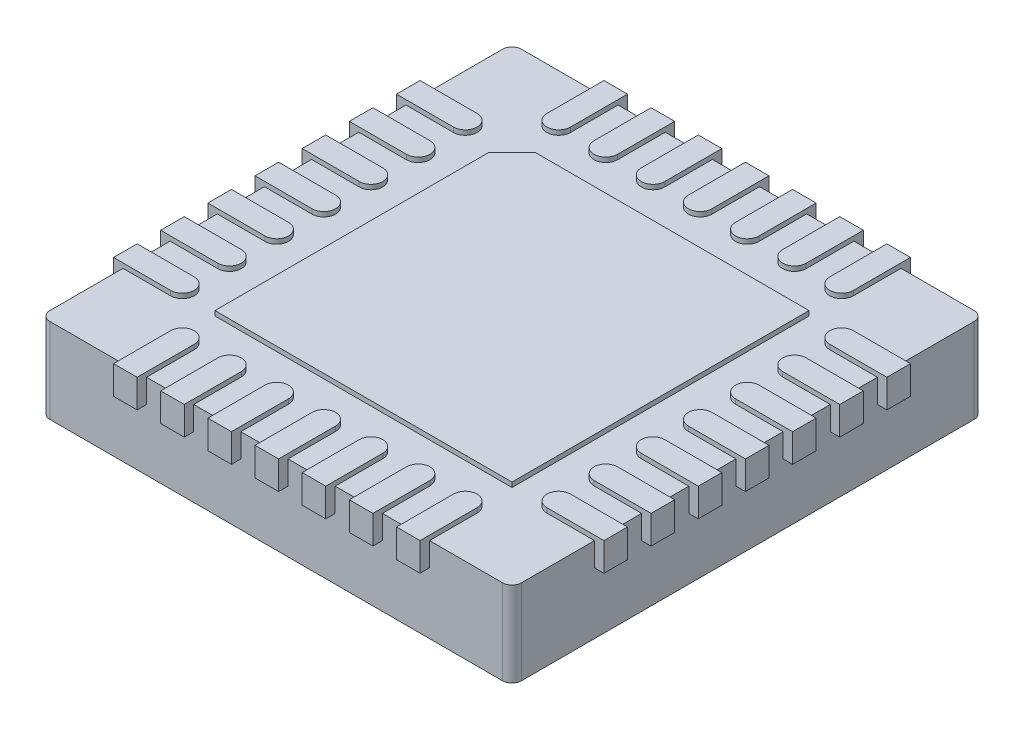
from build123d import *

# Parameters (mm, degrees)
BOSS_EXTRUDE1_DEPTH      = 0.9
BOSS_EXTRUDE2_DEPTH      = 0.05
BOSS_EXTRUDE2_DEPTH_BACK = 0.25
BOSS_EXTRUDE4_DEPTH      = 0.01


with BuildPart() as part:
    # Sketch1 → Boss-Extrude1 (new body)
    with BuildSketch(Plane(origin=(0, 0, 0), x_dir=(1, 0, 0), z_dir=(0, 1, 0))):
        with BuildLine():
            Line((2.4, -2.5), (-2.4, -2.5))
            ThreePointArc((-2.4, -2.5), (-2.470710678, -2.470710678), (-2.5, -2.4))
            Line((-2.5, -2.4), (-2.5, 2.4))
            ThreePointArc((-2.5, 2.4), (-2.470710678, 2.470710678), (-2.4, 2.5))
            Line((-2.4, 2.5), (2.4, 2.5))
            ThreePointArc((2.4, 2.5), (2.470710678, 2.470710678), (2.5, 2.4))
            Line((2.5, 2.4), (2.5, -2.4))
            ThreePointArc((2.5, -2.4), (2.470710678, -2.470710678), (2.4, -2.5))
        make_face()
    extrude(amount=BOSS_EXTRUDE1_DEPTH)

    # Sketch3 → Boss-Extrude2 (add, two sides: drawn at the far end of the back side and taken through both)
    with BuildSketch(Plane(origin=(0, 0.9, 0), x_dir=(1, 0, 0), z_dir=(0, 1, 0)).offset(-BOSS_EXTRUDE2_DEPTH_BACK)):
        Polygon((-1.575, 1.327512627), (-1.327512627, 1.575), (1.575, 1.575), (1.575, -1.575), (-1.575, -1.575), align=None)
        with BuildLine():
            Line((-1.625, 2.6), (-1.375, 2.6))
            Line((-1.375, 2.6), (-1.375, 1.995))
            ThreePointArc((-1.375, 1.995), (-1.5, 1.87), (-1.625, 1.995))
            Line((-1.625, 1.995), (-1.625, 2.6))
        make_face()
        with BuildLine():
            Line((-0.875, 2.6), (-0.875, 1.995))
            ThreePointArc((-0.875, 1.995), (-1, 1.87), (-1.125, 1.995))
            Line((-1.125, 1.995), (-1.125, 2.6))
            Line((-1.125, 2.6), (-0.875, 2.6))
        make_face()
        with BuildLine():
            Line((-0.375, 2.6), (-0.375, 1.995))
            ThreePointArc((-0.375, 1.995), (-0.5, 1.87), (-0.625, 1.995))
            Line((-0.625, 1.995), (-0.625, 2.6))
            Line((-0.625, 2.6), (-0.375, 2.6))
        make_face()
        with BuildLine():
            Line((0.125, 2.6), (0.125, 1.995))
            ThreePointArc((0.125, 1.995), (0, 1.87), (-0.125, 1.995))
            Line((-0.125, 1.995), (-0.125, 2.6))
            Line((-0.125, 2.6), (0.125, 2.6))
        make_face()
        with BuildLine():
            Line((0.625, 2.6), (0.625, 1.995))
            ThreePointArc((0.625, 1.995), (0.5, 1.87), (0.375, 1.995))
            Line((0.375, 1.995), (0.375, 2.6))
            Line((0.375, 2.6), (0.625, 2.6))
        make_face()
        with BuildLine():
            Line((1.125, 2.6), (1.125, 1.995))
            ThreePointArc((1.125, 1.995), (1, 1.87), (0.875, 1.995))
            Line((0.875, 1.995), (0.875, 2.6))
            Line((0.875, 2.6), (1.125, 2.6))
        make_face()
        with BuildLine():
            Line((1.625, 2.6), (1.625, 1.995))
            ThreePointArc((1.625, 1.995), (1.5, 1.87), (1.375, 1.995))
            Line((1.375, 1.995), (1.375, 2.6))
            Line((1.375, 2.6), (1.625, 2.6))
        make_face()
        with BuildLine():
            Line((-2.6, -1.375), (-2.6, -1.625))
            Line((-2.6, -1.625), (-1.995, -1.625))
            ThreePointArc((-1.995, -1.625), (-1.87, -1.5), (-1.995, -1.375))
            Line((-1.995, -1.375), (-2.6, -1.375))
        make_face()
        with BuildLine():
            Line((-2.6, -0.875), (-2.6, -1.125))
            Line((-2.6, -1.125), (-1.995, -1.125))
            ThreePointArc((-1.995, -1.125), (-1.87, -1), (-1.995, -0.875))
            Line((-1.995, -0.875), (-2.6, -0.875))
        make_face()
        with BuildLine():
            Line((-2.6, -0.375), (-2.6, -0.625))
            Line((-2.6, -0.625), (-1.995, -0.625))
            ThreePointArc((-1.995, -0.625), (-1.87, -0.5), (-1.995, -0.375))
            Line((-1.995, -0.375), (-2.6, -0.375))
        make_face()
        with BuildLine():
            Line((-2.6, 0.125), (-2.6, -0.125))
            Line((-2.6, -0.125), (-1.995, -0.125))
            ThreePointArc((-1.995, -0.125), (-1.87, 0), (-1.995, 0.125))
            Line((-1.995, 0.125), (-2.6, 0.125))
        make_face()
        with BuildLine():
            Line((-2.6, 0.625), (-2.6, 0.375))
            Line((-2.6, 0.375), (-1.995, 0.375))
            ThreePointArc((-1.995, 0.375), (-1.87, 0.5), (-1.995, 0.625))
            Line((-1.995, 0.625), (-2.6, 0.625))
        make_face()
        with BuildLine():
            Line((-2.6, 1.125), (-2.6, 0.875))
            Line((-2.6, 0.875), (-1.995, 0.875))
            ThreePointArc((-1.995, 0.875), (-1.87, 1), (-1.995, 1.125))
            Line((-1.995, 1.125), (-2.6, 1.125))
        make_face()
        with BuildLine():
            Line((-2.6, 1.625), (-2.6, 1.375))
            Line((-2.6, 1.375), (-1.995, 1.375))
            ThreePointArc((-1.995, 1.375), (-1.87, 1.5), (-1.995, 1.625))
            Line((-1.995, 1.625), (-2.6, 1.625))
        make_face()
        with BuildLine():
            Line((2.6, 1.375), (2.6, 1.625))
            Line((2.6, 1.625), (1.995, 1.625))
            ThreePointArc((1.995, 1.625), (1.87, 1.5), (1.995, 1.375))
            Line((1.995, 1.375), (2.6, 1.375))
        make_face()
        with BuildLine():
            Line((2.6, 0.875), (2.6, 1.125))
            Line((2.6, 1.125), (1.995, 1.125))
            ThreePointArc((1.995, 1.125), (1.87, 1), (1.995, 0.875))
            Line((1.995, 0.875), (2.6, 0.875))
        make_face()
        with BuildLine():
            Line((2.6, 0.375), (2.6, 0.625))
            Line((2.6, 0.625), (1.995, 0.625))
            ThreePointArc((1.995, 0.625), (1.87, 0.5), (1.995, 0.375))
            Line((1.995, 0.375), (2.6, 0.375))
        make_face()
        with BuildLine():
            Line((2.6, -0.125), (2.6, 0.125))
            Line((2.6, 0.125), (1.995, 0.125))
            ThreePointArc((1.995, 0.125), (1.87, 0), (1.995, -0.125))
            Line((1.995, -0.125), (2.6, -0.125))
        make_face()
        with BuildLine():
            Line((2.6, -0.625), (2.6, -0.375))
            Line((2.6, -0.375), (1.995, -0.375))
            ThreePointArc((1.995, -0.375), (1.87, -0.5), (1.995, -0.625))
            Line((1.995, -0.625), (2.6, -0.625))
        make_face()
        with BuildLine():
            Line((2.6, -1.125), (2.6, -0.875))
            Line((2.6, -0.875), (1.995, -0.875))
            ThreePointArc((1.995, -0.875), (1.87, -1), (1.995, -1.125))
            Line((1.995, -1.125), (2.6, -1.125))
        make_face()
        with BuildLine():
            Line((2.6, -1.625), (2.6, -1.375))
            Line((2.6, -1.375), (1.995, -1.375))
            ThreePointArc((1.995, -1.375), (1.87, -1.5), (1.995, -1.625))
            Line((1.995, -1.625), (2.6, -1.625))
        make_face()
        with BuildLine():
            Line((1.625, -2.6), (1.625, -1.995))
            ThreePointArc((1.625, -1.995), (1.5, -1.87), (1.375, -1.995))
            Line((1.375, -1.995), (1.375, -2.6))
            Line((1.375, -2.6), (1.625, -2.6))
        make_face()
        with BuildLine():
            Line((1.125, -2.6), (1.125, -1.995))
            ThreePointArc((1.125, -1.995), (1, -1.87), (0.875, -1.995))
            Line((0.875, -1.995), (0.875, -2.6))
            Line((0.875, -2.6), (1.125, -2.6))
        make_face()
        with BuildLine():
            Line((0.625, -2.6), (0.625, -1.995))
            ThreePointArc((0.625, -1.995), (0.5, -1.87), (0.375, -1.995))
            Line((0.375, -1.995), (0.375, -2.6))
            Line((0.375, -2.6), (0.625, -2.6))
        make_face()
        with BuildLine():
            Line((0.125, -2.6), (0.125, -1.995))
            ThreePointArc((0.125, -1.995), (0, -1.87), (-0.125, -1.995))
            Line((-0.125, -1.995), (-0.125, -2.6))
            Line((-0.125, -2.6), (0.125, -2.6))
        make_face()
        with BuildLine():
            Line((-0.375, -2.6), (-0.375, -1.995))
            ThreePointArc((-0.375, -1.995), (-0.5, -1.87), (-0.625, -1.995))
            Line((-0.625, -1.995), (-0.625, -2.6))
            Line((-0.625, -2.6), (-0.375, -2.6))
        make_face()
        with BuildLine():
            Line((-0.875, -2.6), (-0.875, -1.995))
            ThreePointArc((-0.875, -1.995), (-1, -1.87), (-1.125, -1.995))
            Line((-1.125, -1.995), (-1.125, -2.6))
            Line((-1.125, -2.6), (-0.875, -2.6))
        make_face()
        with BuildLine():
            Line((-1.375, -2.6), (-1.375, -1.995))
            ThreePointArc((-1.375, -1.995), (-1.5, -1.87), (-1.625, -1.995))
            Line((-1.625, -1.995), (-1.625, -2.6))
            Line((-1.625, -2.6), (-1.375, -2.6))
        make_face()
    extrude(amount=BOSS_EXTRUDE2_DEPTH + BOSS_EXTRUDE2_DEPTH_BACK)

    # Sketch4 → Boss-Extrude4 (add)
    # profile 1 of 5: a face of its own
    with BuildSketch(Plane.XZ):
        with BuildLine():
            add(Edge.make_bspline(
                [(-1.973357372, -0.180765499), (-1.981477517, -0.176498283), (-1.997364051, -0.168149754), (-2.019995019, -0.15466662), (-2.041117437, -0.140948002), (-2.06034063, -0.126500661), (-2.077853063, -0.111631698), (-2.09370863, -0.096380456), (-2.108077846, -0.080795169), (-2.120467065, -0.064475169), (-2.131459489, -0.047710673), (-2.140771421, -0.030295064), (-2.148898372, -0.012479999), (-2.155277016, 0.006004991), (-2.160543318, 0.024906317), (-2.164164125, 0.044477604), (-2.16611203, 0.064587298), (-2.166480233, 0.078178258), (-2.166666667, 0.085059822)],
                knots=[0, 0, 0, 0, 1.264219729, 2.473363326, 3.62979159, 4.734286947, 5.785533755, 6.79450939, 7.765315851, 8.704182021, 9.615576613, 10.525715488, 11.423813905, 12.311666436, 13.218214638, 14.126256791, 15.051260205, 16, 16, 16, 16], degree=3))
            add(Edge.make_bspline(
                [(-2.166666667, 0.085059822), (-2.166447496, 0.09468816), (-2.166013675, 0.113746255), (-2.162195719, 0.141867684), (-2.156556093, 0.169289895), (-2.147988961, 0.195702027), (-2.137446698, 0.221329116), (-2.124143755, 0.245825897), (-2.109129663, 0.269895558), (-2.097055177, 0.284700144), (-2.090945513, 0.292191232)],
                knots=[0, 0, 0, 0, 1.02531512, 2.029483338, 3.018748588, 4.004195107, 4.983200899, 5.966616707, 6.971112471, 8, 8, 8, 8], degree=3))
            add(Edge.make_bspline(
                [(-2.090945513, 0.292191232), (-2.082992234, 0.30093231), (-2.067183959, 0.318306451), (-2.040103122, 0.340863826), (-2.010382584, 0.359820795), (-1.978137346, 0.375269908), (-1.943453603, 0.387294439), (-1.906338744, 0.395935159), (-1.866720415, 0.400884424), (-1.83949028, 0.40159985), (-1.825520833, 0.401966873)],
                knots=[0, 0, 0, 0, 0.954267603, 1.896743057, 2.838368354, 3.796610408, 4.779680527, 5.799409237, 6.871065594, 8, 8, 8, 8], degree=3))
            add(Edge.make_bspline(
                [(-1.825520833, 0.401966873), (-1.812088746, 0.40163671), (-1.785951268, 0.400994246), (-1.747901901, 0.396665146), (-1.712390855, 0.389000983), (-1.679249764, 0.378727923), (-1.648799092, 0.365028552), (-1.620983473, 0.348237124), (-1.595395219, 0.328732732), (-1.572837066, 0.306045982), (-1.552815461, 0.281741552), (-1.535212542, 0.256675166), (-1.520663785, 0.230865069), (-1.508123925, 0.204703859), (-1.498791835, 0.177661454), (-1.492172901, 0.150015372), (-1.488015287, 0.121844151), (-1.487459227, 0.102835651), (-1.487179487, 0.093272963)],
                knots=[0, 0, 0, 0, 1.256864279, 2.445730223, 3.576845088, 4.651810441, 5.686528262, 6.692706664, 7.686234615, 8.689148594, 9.678739427, 10.630299996, 11.55097961, 12.448208961, 13.341360817, 14.221834469, 15.105450545, 16, 16, 16, 16], degree=3))
            add(Edge.make_bspline(
                [(-1.487179487, 0.093272963), (-1.487344636, 0.086256067), (-1.48767103, 0.072388203), (-1.489928973, 0.051899595), (-1.493562128, 0.031958688), (-1.498485388, 0.012486775), (-1.505218805, -0.006413404), (-1.51320704, -0.024839317), (-1.522611109, -0.042790431), (-1.53380132, -0.059993446), (-1.546130032, -0.077057733), (-1.560765346, -0.093135972), (-1.576731536, -0.109172577), (-1.594979073, -0.124192363), (-1.614522456, -0.139436175), (-1.636273144, -0.1536299), (-1.659505878, -0.167881289), (-1.6760225, -0.176397074), (-1.684495192, -0.180765499)],
                knots=[0, 0, 0, 0, 0.941575622, 1.860885767, 2.762557628, 3.660168386, 4.552890429, 5.45184204, 6.353736508, 7.268493418, 8.204037487, 9.175167802, 10.182660057, 11.238220596, 12.344046335, 13.507168087, 14.721227736, 16, 16, 16, 16], degree=3))
            add(Edge.make_bspline(
                [(-1.684495192, -0.180765499), (-1.672911776, -0.187108088), (-1.650518112, -0.199369911), (-1.620583203, -0.221617269), (-1.595225803, -0.246149122), (-1.574715395, -0.273002386), (-1.558521389, -0.301294488), (-1.547072042, -0.330876486), (-1.539598792, -0.361418442), (-1.538841745, -0.382245024), (-1.538461538, -0.392704601)],
                knots=[0, 0, 0, 0, 1.16701039, 2.256125286, 3.287752239, 4.277689688, 5.235169525, 6.160862735, 7.076343936, 8, 8, 8, 8], degree=3))
            add(Edge.make_bspline(
                [(-1.538461538, -0.392704601), (-1.538929631, -0.403360555), (-1.53987058, -0.42478088), (-1.547453052, -0.456675915), (-1.559903073, -0.488019119), (-1.576546897, -0.518737859), (-1.59772822, -0.547432404), (-1.622799276, -0.573376403), (-1.651728528, -0.595898399), (-1.68388012, -0.614936887), (-1.718417911, -0.630506172), (-1.75491982, -0.64113509), (-1.792735292, -0.648125738), (-1.818477978, -0.648914996), (-1.831530449, -0.649315178)],
                knots=[0, 0, 0, 0, 0.888724595, 1.786491426, 2.720083884, 3.697804067, 4.69440576, 5.687697823, 6.7000873, 7.744853364, 8.800284131, 9.853047784, 10.91141782, 12, 12, 12, 12], degree=3))
            add(Edge.make_bspline(
                [(-1.831530449, -0.649315178), (-1.844246299, -0.648903723), (-1.869320507, -0.648092379), (-1.906232059, -0.641258723), (-1.941579721, -0.629973356), (-1.97516538, -0.614602647), (-2.006274408, -0.595450293), (-2.033958563, -0.572680446), (-2.058443846, -0.547019136), (-2.078673109, -0.518229951), (-2.094901251, -0.487513259), (-2.106587382, -0.455649909), (-2.11397545, -0.423021893), (-2.114914254, -0.400955751), (-2.115384615, -0.389900114)],
                knots=[0, 0, 0, 0, 1.072634126, 2.115112298, 3.156050586, 4.19761425, 5.225177188, 6.230426315, 7.215180151, 8.209739481, 9.190420596, 10.139012357, 11.067603024, 12, 12, 12, 12], degree=3))
            add(Edge.make_bspline(
                [(-2.115384615, -0.389900114), (-2.114972261, -0.379050591), (-2.114162422, -0.357742745), (-2.107439629, -0.326725597), (-2.095941566, -0.297737551), (-2.080430643, -0.270332542), (-2.060072203, -0.244948501), (-2.035277302, -0.221459363), (-2.006367682, -0.199405729), (-1.98460677, -0.187117798), (-1.973357372, -0.180765499)],
                knots=[0, 0, 0, 0, 0.975463758, 1.915755378, 2.838359076, 3.772025586, 4.738400888, 5.753889765, 6.838863581, 8, 8, 8, 8], degree=3))
        make_face()
        with BuildLine():
            add(Edge.make_bspline(
                [(-1.826522436, -0.546751076), (-1.819507675, -0.546565552), (-1.805783735, -0.546202587), (-1.785664691, -0.54429168), (-1.766517375, -0.540621127), (-1.748237081, -0.535592518), (-1.730761189, -0.529335922), (-1.714490452, -0.521092642), (-1.69887808, -0.511930203), (-1.684436251, -0.501183079), (-1.67136273, -0.489457734), (-1.65968577, -0.477212459), (-1.650172672, -0.464086267), (-1.641988205, -0.450735844), (-1.635910094, -0.43660745), (-1.631592415, -0.422010428), (-1.628536759, -0.406852323), (-1.628316531, -0.396525965), (-1.628205128, -0.391302358)],
                knots=[0, 0, 0, 0, 1.20353747, 2.354645537, 3.462130888, 4.543058862, 5.604822423, 6.639552563, 7.666902586, 8.706944258, 9.720926464, 10.677177239, 11.602682187, 12.496457588, 13.358248655, 14.231532794, 15.105417644, 16, 16, 16, 16], degree=3))
            add(Edge.make_bspline(
                [(-1.628205128, -0.391302358), (-1.628408301, -0.386081708), (-1.628809799, -0.375764955), (-1.631715859, -0.360468928), (-1.636574814, -0.345633255), (-1.643237487, -0.331119443), (-1.65178778, -0.316964744), (-1.662165283, -0.303114919), (-1.674820272, -0.289936215), (-1.688795199, -0.277054728), (-1.704060334, -0.265186823), (-1.720101214, -0.25458576), (-1.737034906, -0.246134687), (-1.754354286, -0.238724823), (-1.772425618, -0.233166565), (-1.791124298, -0.229162168), (-1.810430352, -0.226685199), (-1.823510296, -0.226388415), (-1.830128205, -0.226238255)],
                knots=[0, 0, 0, 0, 0.873213166, 1.72559466, 2.594724523, 3.479581045, 4.391597569, 5.35687048, 6.368548091, 7.443976143, 8.534559525, 9.600545123, 10.654815915, 11.696401765, 12.749428718, 13.812189468, 14.893058657, 16, 16, 16, 16], degree=3))
            add(Edge.make_bspline(
                [(-1.830128205, -0.226238255), (-1.838628744, -0.226486388), (-1.855545862, -0.226980203), (-1.880475288, -0.231613421), (-1.904775719, -0.238809247), (-1.927987349, -0.249022422), (-1.949694745, -0.261474736), (-1.969285668, -0.276159498), (-1.985940275, -0.293421571), (-2.000109107, -0.312259621), (-2.011187128, -0.332242242), (-2.019673065, -0.352377365), (-2.024670533, -0.372830843), (-2.025320163, -0.386536245), (-2.025641026, -0.393305563)],
                knots=[0, 0, 0, 0, 1.076561449, 2.142489767, 3.202892658, 4.283174188, 5.348766409, 6.369549039, 7.375093932, 8.378927502, 9.349008457, 10.26378795, 11.142457041, 12, 12, 12, 12], degree=3))
            add(Edge.make_bspline(
                [(-2.025641026, -0.393305563), (-2.025491866, -0.398057426), (-2.025195805, -0.407489195), (-2.02265726, -0.42146298), (-2.018697904, -0.435127579), (-2.012926584, -0.448402774), (-2.005945083, -0.461596959), (-1.997045937, -0.474296221), (-1.986732335, -0.486884874), (-1.974855385, -0.498948558), (-1.961436881, -0.510274268), (-1.946368278, -0.520091885), (-1.929782551, -0.528278684), (-1.911902058, -0.535156608), (-1.892537841, -0.5402649), (-1.871856621, -0.544109074), (-1.849671791, -0.546271329), (-1.834406248, -0.546587692), (-1.826522436, -0.546751076)],
                knots=[0, 0, 0, 0, 0.814035228, 1.61574325, 2.427118093, 3.24780647, 4.092880925, 4.981933388, 5.900917883, 6.880367106, 7.87994501, 8.905470125, 9.95492938, 11.0455354, 12.184050453, 13.382997595, 14.64846247, 16, 16, 16, 16], degree=3))
        make_face(mode=Mode.SUBTRACT)
        with BuildLine():
            add(Edge.make_bspline(
                [(-1.832331731, -0.123674152), (-1.823438674, -0.123515924), (-1.805992665, -0.123205518), (-1.780433198, -0.119752015), (-1.755904979, -0.114941289), (-1.732483306, -0.107655189), (-1.710288405, -0.098174982), (-1.689007924, -0.086933081), (-1.66897511, -0.073458552), (-1.650279502, -0.058078138), (-1.633163171, -0.041410752), (-1.618092002, -0.023807767), (-1.605359001, -0.005508208), (-1.595026028, 0.013511071), (-1.587009981, 0.033208163), (-1.581094015, 0.053594565), (-1.577659213, 0.07472714), (-1.577169824, 0.089054175), (-1.576923077, 0.096277771)],
                knots=[0, 0, 0, 0, 1.140332253, 2.237053636, 3.304055028, 4.344690294, 5.377465719, 6.397042765, 7.428360044, 8.469453732, 9.499453352, 10.490108612, 11.438398528, 12.354680514, 13.261581007, 14.161901135, 15.073242693, 16, 16, 16, 16], degree=3))
            add(Edge.make_bspline(
                [(-1.576923077, 0.096277771), (-1.577319777, 0.105256461), (-1.578109702, 0.123135176), (-1.584151696, 0.149491577), (-1.594074398, 0.174999892), (-1.607994779, 0.199300366), (-1.624974388, 0.222098367), (-1.645616416, 0.242250359), (-1.669417587, 0.259485064), (-1.696182363, 0.273889741), (-1.725521799, 0.285298441), (-1.757254582, 0.293460587), (-1.791165764, 0.298590841), (-1.814551151, 0.299127862), (-1.826522436, 0.299402771)],
                knots=[0, 0, 0, 0, 0.899105568, 1.790333855, 2.694925079, 3.632758987, 4.588257081, 5.534574046, 6.511571685, 7.523527334, 8.572244311, 9.657983075, 10.801090915, 12, 12, 12, 12], degree=3))
            add(Edge.make_bspline(
                [(-1.826522436, 0.299402771), (-1.835879035, 0.299221013), (-1.854108691, 0.298866891), (-1.88071366, 0.295806148), (-1.905761578, 0.290806496), (-1.929492412, 0.284027504), (-1.95172953, 0.275041357), (-1.972442619, 0.2638797), (-1.991913737, 0.251130675), (-2.009310725, 0.236036933), (-2.025128865, 0.219885694), (-2.038984308, 0.202877907), (-2.050710274, 0.185183904), (-2.060162529, 0.166814043), (-2.067668522, 0.147835832), (-2.073079489, 0.128171365), (-2.07641442, 0.107743403), (-2.076751973, 0.093886628), (-2.076923077, 0.086862706)],
                knots=[0, 0, 0, 0, 1.224631902, 2.385975653, 3.500340538, 4.565441647, 5.612488581, 6.63322211, 7.641830068, 8.652595074, 9.641693811, 10.598750962, 11.520088299, 12.415429315, 13.298523938, 14.187139574, 15.081071174, 16, 16, 16, 16], degree=3))
            add(Edge.make_bspline(
                [(-2.076923077, 0.086862706), (-2.076665973, 0.080039832), (-2.076159009, 0.066586316), (-2.072895155, 0.046664289), (-2.067292197, 0.027338235), (-2.05912214, 0.00869532), (-2.049088895, -0.009481323), (-2.036694636, -0.027039098), (-2.022090424, -0.04402662), (-2.005312005, -0.060094137), (-1.987127988, -0.074947827), (-1.967856901, -0.088147977), (-1.947410918, -0.098936581), (-1.926195067, -0.107999768), (-1.903995473, -0.115062767), (-1.880919212, -0.120015435), (-1.856922568, -0.123128183), (-1.840621282, -0.123490107), (-1.832331731, -0.123674152)],
                knots=[0, 0, 0, 0, 0.917336384, 1.808827106, 2.706624561, 3.615530867, 4.539869921, 5.493819324, 6.499753197, 7.547410123, 8.613069608, 9.653934021, 10.682176708, 11.716048074, 12.752411263, 13.808993382, 14.885826486, 16, 16, 16, 16], degree=3))
        make_face(mode=Mode.SUBTRACT)
    # profile 2 of 5: a face of its own
    with BuildSketch(Plane.XZ):
        with BuildLine():
            Line((-0.846153846, -0.315981845), (-0.756410256, -0.315981845))
            add(Edge.make_bspline(
                [(-0.756410256, -0.315981845), (-0.756995058, -0.327887871), (-0.758143592, -0.351270991), (-0.763524512, -0.385362705), (-0.771216807, -0.417952796), (-0.782118583, -0.448761863), (-0.795581325, -0.478157948), (-0.812063616, -0.505750702), (-0.831214082, -0.531813983), (-0.852997589, -0.555854324), (-0.876634703, -0.577830202), (-0.901983799, -0.597008321), (-0.928784337, -0.613026564), (-0.95680386, -0.626490267), (-0.986366424, -0.63658414), (-1.017189441, -0.644076917), (-1.049412231, -0.648584205), (-1.071366498, -0.649068748), (-1.082532051, -0.649315178)],
                knots=[0, 0, 0, 0, 1.100776268, 2.161895295, 3.184016182, 4.190939212, 5.176500551, 6.166955529, 7.155448256, 8.160289653, 9.16017456, 10.133824356, 11.091467644, 12.04088621, 13.000931625, 13.972173743, 14.968683325, 16, 16, 16, 16], degree=3))
            add(Edge.make_bspline(
                [(-1.082532051, -0.649315178), (-1.093497987, -0.649060559), (-1.115045659, -0.648560243), (-1.146481032, -0.644199051), (-1.176477918, -0.637515913), (-1.204696361, -0.627612555), (-1.231425962, -0.615186007), (-1.256335764, -0.599731966), (-1.280028113, -0.581981667), (-1.301340228, -0.561044318), (-1.320917978, -0.538704113), (-1.337792814, -0.514844963), (-1.352325556, -0.490173867), (-1.364220151, -0.464498108), (-1.373236783, -0.437734073), (-1.379917243, -0.410138359), (-1.383736155, -0.381392492), (-1.384319041, -0.361932916), (-1.384615385, -0.352039537)],
                knots=[0, 0, 0, 0, 1.111674182, 2.184400057, 3.212814286, 4.223731311, 5.211378316, 6.196328225, 7.191884489, 8.207283132, 9.220262353, 10.201199469, 11.166417575, 12.120932471, 13.06540007, 14.026332106, 14.996573967, 16, 16, 16, 16], degree=3))
            add(Edge.make_bspline(
                [(-1.384615385, -0.352039537), (-1.384131588, -0.33811159), (-1.383172484, -0.310500113), (-1.374968487, -0.26992435), (-1.362154774, -0.230612279), (-1.346728325, -0.198971971), (-1.33116171, -0.173479101), (-1.317147959, -0.152479168), (-1.300649248, -0.129873836), (-1.281806532, -0.105571611), (-1.260295315, -0.07989075), (-1.236674454, -0.052307295), (-1.210333933, -0.023331283), (-1.191862896, -0.003527383), (-1.182291667, 0.006734501)],
                knots=[0, 0, 0, 0, 1.184416499, 2.348048165, 3.509039915, 4.696071444, 5.333504901, 6.05069495, 6.844171097, 7.714965912, 8.667477798, 9.695072654, 10.805644396, 12, 12, 12, 12], degree=3))
            Line((-1.182291667, 0.006734501), (-0.932091346, 0.273761745))
            Line((-0.932091346, 0.273761745), (-1.397435897, 0.273761745))
            Line((-1.397435897, 0.273761745), (-1.397435897, 0.376325848))
            Line((-1.397435897, 0.376325848), (-0.717948718, 0.376325848))
            Line((-0.717948718, 0.376325848), (-1.105769231, -0.037536332))
            add(Edge.make_bspline(
                [(-1.105769231, -0.037536332), (-1.115212153, -0.047392453), (-1.133350073, -0.066324045), (-1.158993443, -0.093971964), (-1.18206236, -0.119591203), (-1.202572127, -0.143295287), (-1.220539619, -0.164949836), (-1.235907349, -0.184724552), (-1.248743239, -0.202449733), (-1.262346608, -0.223272535), (-1.275318323, -0.248726115), (-1.286719133, -0.279675256), (-1.293621028, -0.311605426), (-1.294453203, -0.333176355), (-1.294871795, -0.344026717)],
                knots=[0, 0, 0, 0, 1.329530082, 2.553755191, 3.672934919, 4.687409497, 5.60679272, 6.413407421, 7.126401618, 7.737995624, 8.834647426, 9.90044882, 10.943907757, 12, 12, 12, 12], degree=3))
            add(Edge.make_bspline(
                [(-1.294871795, -0.344026717), (-1.29469202, -0.350850727), (-1.294337718, -0.364299542), (-1.291151605, -0.384004655), (-1.286470573, -0.403086235), (-1.279255655, -0.421308352), (-1.270587198, -0.439029402), (-1.259512605, -0.455710607), (-1.246857252, -0.471920591), (-1.232177664, -0.487103526), (-1.216062205, -0.501013452), (-1.199034723, -0.513334356), (-1.181020552, -0.523631313), (-1.162094764, -0.532072294), (-1.142310355, -0.538693837), (-1.121628996, -0.543282001), (-1.10010785, -0.546162711), (-1.085412565, -0.546552474), (-1.077924679, -0.546751076)],
                knots=[0, 0, 0, 0, 0.991504627, 1.954065223, 2.895985987, 3.842598665, 4.797835564, 5.759220273, 6.74786863, 7.784730864, 8.824135544, 9.839918996, 10.835834653, 11.835434876, 12.84861661, 13.863796685, 14.911511676, 16, 16, 16, 16], degree=3))
            add(Edge.make_bspline(
                [(-1.077924679, -0.546751076), (-1.070102444, -0.546554904), (-1.054740865, -0.546169655), (-1.032235132, -0.543249786), (-1.010615126, -0.538827793), (-0.990214006, -0.531788017), (-0.970604811, -0.523548879), (-0.952287782, -0.512880644), (-0.934748372, -0.500690536), (-0.918339215, -0.486477644), (-0.903394019, -0.47043343), (-0.88979824, -0.452969587), (-0.878278402, -0.433776516), (-0.868052358, -0.41331476), (-0.860231453, -0.39102215), (-0.85354514, -0.36744388), (-0.848688299, -0.342243543), (-0.847012695, -0.324881137), (-0.846153846, -0.315981845)],
                knots=[0, 0, 0, 0, 1.031072318, 2.024855787, 2.988461151, 3.935103592, 4.865765533, 5.788564469, 6.724086513, 7.67908574, 8.64457978, 9.611397706, 10.591395687, 11.591555111, 12.622101007, 13.700900657, 14.821571223, 16, 16, 16, 16], degree=3))
        make_face()
    # profile 3 of 5: a face of its own
    with BuildSketch(Plane.XZ):
        Polygon((0.217948718, 0.376325848), (0.217948718, -0.623674152), (0.19911859, -0.623674152), (-0.461538462, 0.163385142), (-0.461538462, -0.623674152), (-0.551282051, -0.623674152), (-0.551282051, 0.376325848), (-0.530849359, 0.376325848), (0.128205128, -0.408930563), (0.128205128, 0.376325848), align=None)
    # profile 4 of 5: a face of its own
    with BuildSketch(Plane.XZ):
        Polygon((0.884615385, -0.623674152), (0.397435897, -0.623674152), (0.397435897, -0.52111005), (0.794871795, -0.52111005), (0.794871795, -0.213417742), (0.397435897, -0.213417742), (0.397435897, -0.11085364), (0.794871795, -0.11085364), (0.794871795, 0.376325848), (0.884615385, 0.376325848), align=None)
    # profile 5 of 5: a face of its own
    with BuildSketch(Plane.XZ):
        with BuildLine():
            Line((1.256209936, 0.264947642), (1.102564103, 0.453248924))
            Line((1.102564103, 0.453248924), (1.214543269, 0.453248924))
            Line((1.214543269, 0.453248924), (1.325520833, 0.317431617))
            add(Edge.make_bspline(
                [(1.325520833, 0.317431617), (1.336652072, 0.324193533), (1.358709502, 0.337592806), (1.39309062, 0.354898166), (1.428219556, 0.369172877), (1.463777002, 0.381451979), (1.500127929, 0.390551906), (1.537054872, 0.397256116), (1.574639806, 0.401058734), (1.599885143, 0.401663006), (1.612580128, 0.401966873)],
                knots=[0, 0, 0, 0, 1.030168789, 2.04136103, 3.041061446, 4.02840172, 5.015006777, 6.002573162, 6.995564809, 8, 8, 8, 8], degree=3))
            add(Edge.make_bspline(
                [(1.612580128, 0.401966873), (1.630768494, 0.401527964), (1.666557785, 0.400664322), (1.719125, 0.393150052), (1.769623126, 0.381470298), (1.817922423, 0.364797839), (1.863936149, 0.343156461), (1.907805642, 0.316746001), (1.949546285, 0.28561697), (1.988519545, 0.25007053), (2.02415501, 0.211396755), (2.055423316, 0.170076674), (2.082009719, 0.126794629), (2.103506436, 0.08133513), (2.120566947, 0.034093844), (2.132193224, -0.015322096), (2.139718778, -0.066618531), (2.14058574, -0.101545151), (2.141025641, -0.119267101)],
                knots=[0, 0, 0, 0, 1.05574053, 2.077383083, 3.077194498, 4.061905691, 5.03852134, 6.024727803, 7.030589082, 8.057245348, 9.083652609, 10.080210343, 11.061793968, 12.027891381, 12.99559829, 13.972775731, 14.971375788, 16, 16, 16, 16], degree=3))
            add(Edge.make_bspline(
                [(2.141025641, -0.119267101), (2.14087078, -0.13116207), (2.140562146, -0.154868436), (2.136922644, -0.190040062), (2.131647368, -0.224590205), (2.123925109, -0.258433528), (2.114173905, -0.291649267), (2.102071898, -0.324220874), (2.087822062, -0.356139681), (2.071436953, -0.387216927), (2.053338786, -0.417187164), (2.033411403, -0.445527257), (2.011935696, -0.472227922), (1.988916743, -0.497329221), (1.964148291, -0.520615441), (1.937930513, -0.542247238), (1.910107732, -0.562221659), (1.880822842, -0.580286687), (1.850419168, -0.596572754), (1.819088824, -0.610498189), (1.787214759, -0.622729932), (1.754396745, -0.63221011), (1.720975761, -0.639924372), (1.686759861, -0.645213177), (1.651855496, -0.648865168), (1.628281494, -0.649164259), (1.616386218, -0.649315178)],
                knots=[0, 0, 0, 0, 1.030626684, 2.05401234, 3.061696819, 4.058602899, 5.06035271, 6.060211399, 7.068045458, 8.088070503, 9.103503967, 10.100645233, 11.088606638, 12.071673413, 13.05021482, 14.032855563, 15.015837146, 16.016466104, 17.013321779, 18.002943197, 18.986537994, 19.969996554, 20.961258309, 21.957508933, 22.969373316, 24, 24, 24, 24], degree=3))
            add(Edge.make_bspline(
                [(1.616386218, -0.649315178), (1.598197519, -0.648879217), (1.562473751, -0.648022963), (1.510040536, -0.640496854), (1.459738687, -0.628824008), (1.411592248, -0.612104094), (1.365635748, -0.590501424), (1.321864444, -0.564199354), (1.280343779, -0.53303156), (1.241379338, -0.497679428), (1.206027218, -0.458714988), (1.174859376, -0.417194328), (1.148557484, -0.373423001), (1.126954154, -0.327466589), (1.110236725, -0.279319821), (1.098539402, -0.228954713), (1.091049236, -0.176449338), (1.090183542, -0.140660411), (1.08974359, -0.122472229)],
                knots=[0, 0, 0, 0, 1.050572733, 2.063392076, 3.054553589, 4.030798755, 5.002633919, 5.98401295, 6.976458006, 7.99808884, 9.019719675, 10.012164731, 10.993543762, 11.965378925, 12.941624092, 13.932785605, 14.949427267, 16, 16, 16, 16], degree=3))
            add(Edge.make_bspline(
                [(1.08974359, -0.122472229), (1.09021955, -0.103545982), (1.091155498, -0.066328589), (1.099257009, -0.011855524), (1.11191261, 0.040263685), (1.130373137, 0.089848038), (1.153909966, 0.137213906), (1.182876194, 0.182269744), (1.216702536, 0.225480636), (1.242902114, 0.251653427), (1.256209936, 0.264947642)],
                knots=[0, 0, 0, 0, 1.045555185, 2.056025074, 3.037071613, 4.005098777, 4.973948731, 5.954752269, 6.961136269, 8, 8, 8, 8], degree=3))
        make_face()
        with BuildLine():
            add(Edge.make_bspline(
                [(1.31650641, 0.191029373), (1.305596185, 0.179948134), (1.284135289, 0.158150846), (1.256276298, 0.122411256), (1.232400535, 0.085284937), (1.21305688, 0.046300031), (1.197951212, 0.005757875), (1.187351474, -0.036500236), (1.180763257, -0.080264325), (1.179915666, -0.110029212), (1.179487179, -0.125076396)],
                knots=[0, 0, 0, 0, 1.052185505, 2.069695543, 3.06176622, 4.036333774, 5.010523718, 5.985353414, 6.981526144, 8, 8, 8, 8], degree=3))
            add(Edge.make_bspline(
                [(1.179487179, -0.125076396), (1.179598924, -0.134766805), (1.179819822, -0.153923037), (1.182857172, -0.182270899), (1.187154119, -0.209992662), (1.19337478, -0.237038794), (1.201385464, -0.263354498), (1.211279362, -0.288904052), (1.222863707, -0.313769879), (1.236368523, -0.337797515), (1.251256439, -0.360952133), (1.267828517, -0.382950565), (1.285851494, -0.403679379), (1.305128478, -0.423480178), (1.326031129, -0.441944793), (1.348484482, -0.459065309), (1.37221186, -0.47525604), (1.397330678, -0.489870264), (1.423215612, -0.503305762), (1.4497152, -0.514940072), (1.476606933, -0.524793916), (1.503849167, -0.532784118), (1.531406652, -0.539073425), (1.5593277, -0.543365563), (1.587540108, -0.546399785), (1.606495671, -0.546633879), (1.615985577, -0.546751076)],
                knots=[0, 0, 0, 0, 1.032958288, 2.041976502, 3.037103433, 4.023477888, 4.998866292, 5.968231228, 6.943073582, 7.921783703, 8.90545537, 9.876780072, 10.85618943, 11.833110341, 12.821898168, 13.827467856, 14.842673888, 15.88323808, 16.924703457, 17.951432745, 18.967462636, 19.976958182, 20.977218729, 21.979378626, 22.98839684, 24, 24, 24, 24], degree=3))
            add(Edge.make_bspline(
                [(1.615985577, -0.546751076), (1.625542022, -0.546632913), (1.644630366, -0.546396891), (1.672979841, -0.543384109), (1.700961739, -0.53906219), (1.728472316, -0.532834939), (1.755514712, -0.524720335), (1.782267168, -0.515262534), (1.808330881, -0.503379096), (1.834070835, -0.490382421), (1.858865342, -0.475533499), (1.882388525, -0.459375437), (1.90461677, -0.44207791), (1.925328749, -0.423418662), (1.944440751, -0.40327093), (1.962685961, -0.382320267), (1.979029057, -0.359746829), (1.994088405, -0.336171031), (2.007451569, -0.311498027), (2.019344938, -0.286148144), (2.029148583, -0.259993652), (2.037139655, -0.233202923), (2.043680317, -0.205813153), (2.047893572, -0.177657971), (2.050953901, -0.148915135), (2.051171826, -0.129491935), (2.051282051, -0.119667742)],
                knots=[0, 0, 0, 0, 1.013108443, 2.02361456, 3.020252655, 4.015001864, 5.012143058, 6.0135003, 7.021621269, 8.04781341, 9.0704561, 10.084059466, 11.072892162, 12.055670672, 13.03737692, 14.016755907, 14.999789545, 15.989965403, 16.98188718, 17.97360669, 18.957481781, 19.941050972, 20.937387086, 21.941020626, 22.958574714, 24, 24, 24, 24], degree=3))
            add(Edge.make_bspline(
                [(2.051282051, -0.119667742), (2.050903987, -0.105225149), (2.050160217, -0.076812101), (2.044079053, -0.035078028), (2.033661859, 0.004841573), (2.01983294, 0.043278443), (2.001277701, 0.079752538), (1.97902355, 0.114647642), (1.952276214, 0.147487017), (1.922296545, 0.178584049), (1.88929916, 0.206741096), (1.854337845, 0.231558478), (1.817613157, 0.252502051), (1.77930801, 0.269852669), (1.73919388, 0.283096548), (1.697454711, 0.292425854), (1.654092357, 0.298514229), (1.624553362, 0.299103815), (1.609575321, 0.299402771)],
                knots=[0, 0, 0, 0, 1.0224559, 2.011487063, 2.978294593, 3.940186789, 4.898130893, 5.87007047, 6.865534992, 7.892148276, 8.925090732, 9.932666584, 10.923854359, 11.914331309, 12.905710806, 13.90942916, 14.939955271, 16, 16, 16, 16], degree=3))
            add(Edge.make_bspline(
                [(1.609575321, 0.299402771), (1.599284725, 0.299289079), (1.578930654, 0.299064205), (1.548909773, 0.296064091), (1.519727739, 0.291736537), (1.491374609, 0.285580416), (1.463938809, 0.277239536), (1.437247897, 0.267504269), (1.411446366, 0.255881499), (1.39503614, 0.246705752), (1.38681891, 0.242111104)],
                knots=[0, 0, 0, 0, 1.060649269, 2.097889346, 3.10764138, 4.101613775, 5.086194395, 6.062070301, 7.029604192, 8, 8, 8, 8], degree=3))
            Line((1.38681891, 0.242111104), (1.611979167, -0.033930563))
            Line((1.611979167, -0.033930563), (1.5, -0.033930563))
            Line((1.5, -0.033930563), (1.31650641, 0.191029373))
        make_face(mode=Mode.SUBTRACT)
    extrude(amount=BOSS_EXTRUDE4_DEPTH)


solid = part.part
